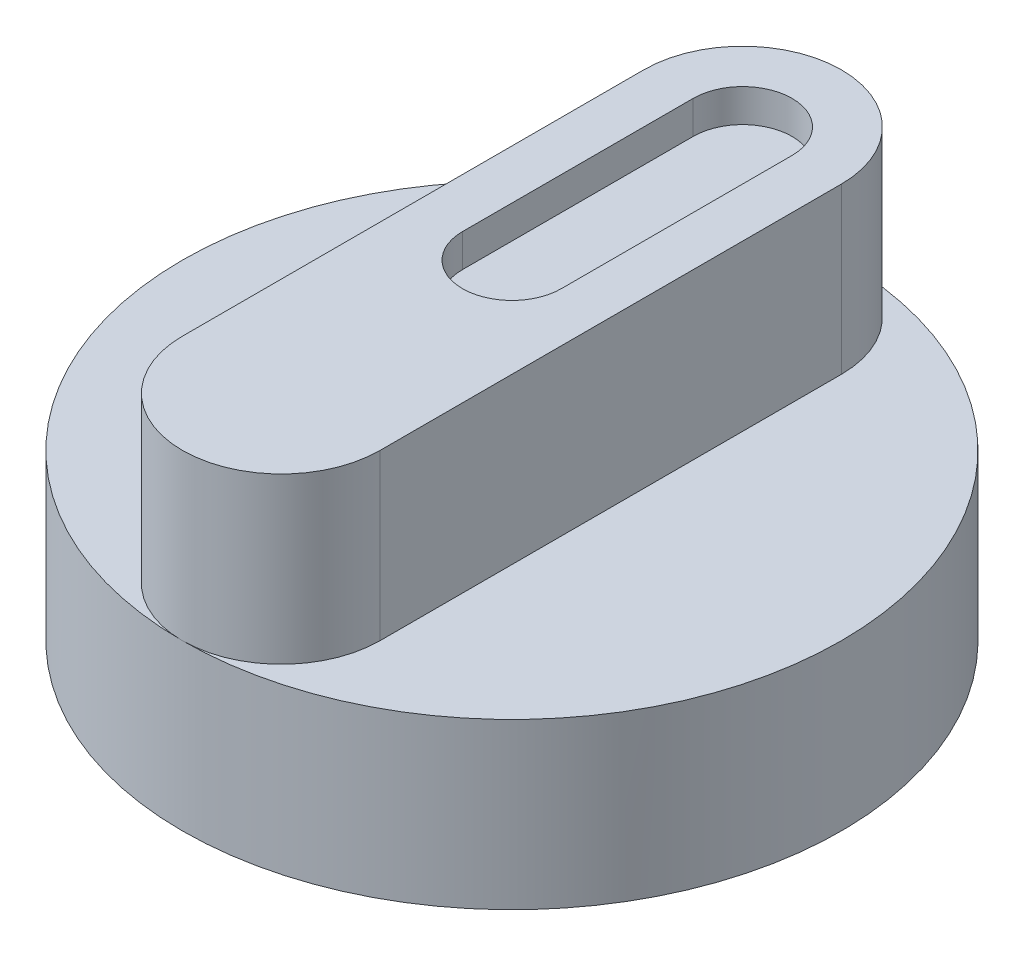
from build123d import *

# Parameters (mm, degrees)
SKETCH_1_R          = 20
EXTRUDE_1_DEPTH     = 10
EXTRUDE_2_DEPTH     = 10
CUT_EXTRUDE_1_DEPTH = 2


with BuildPart() as part:
    # 스케치1 → 보스-돌출1 (new body)
    with BuildSketch(Plane(origin=(0, 0, 0), x_dir=(1, 0, 0), z_dir=(0, 1, 0))):
        with Locations(Location((0, 0, 0), (0, 0, 270))):
            Circle(SKETCH_1_R)
    extrude(amount=EXTRUDE_1_DEPTH)

    # 스케치2 → 보스-돌출2 (add)
    with BuildSketch(Plane(origin=(0, 10, 0), x_dir=(1, 0, 0), z_dir=(0, 1, 0))):
        with BuildLine():
            Line((6, 14), (6, -14))
            ThreePointArc((6, -14), (0, -20), (-6, -14))
            Line((-6, -14), (-6, 14))
            ThreePointArc((-6, 14), (0, 20), (6, 14))
        make_face()
    extrude(amount=EXTRUDE_2_DEPTH)

    # 스케치3 → 컷-돌출1 (cut)
    with BuildSketch(Plane(origin=(0, 20, 0), x_dir=(1, 0, 0), z_dir=(0, 1, 0))):
        with BuildLine():
            Line((3, 14), (3, 0))
            ThreePointArc((3, 0), (0, -3), (-3, 0))
            Line((-3, 0), (-3, 14))
            ThreePointArc((-3, 14), (0, 17), (3, 14))
        make_face()
    extrude(amount=-CUT_EXTRUDE_1_DEPTH, mode=Mode.SUBTRACT)


solid = part.part
